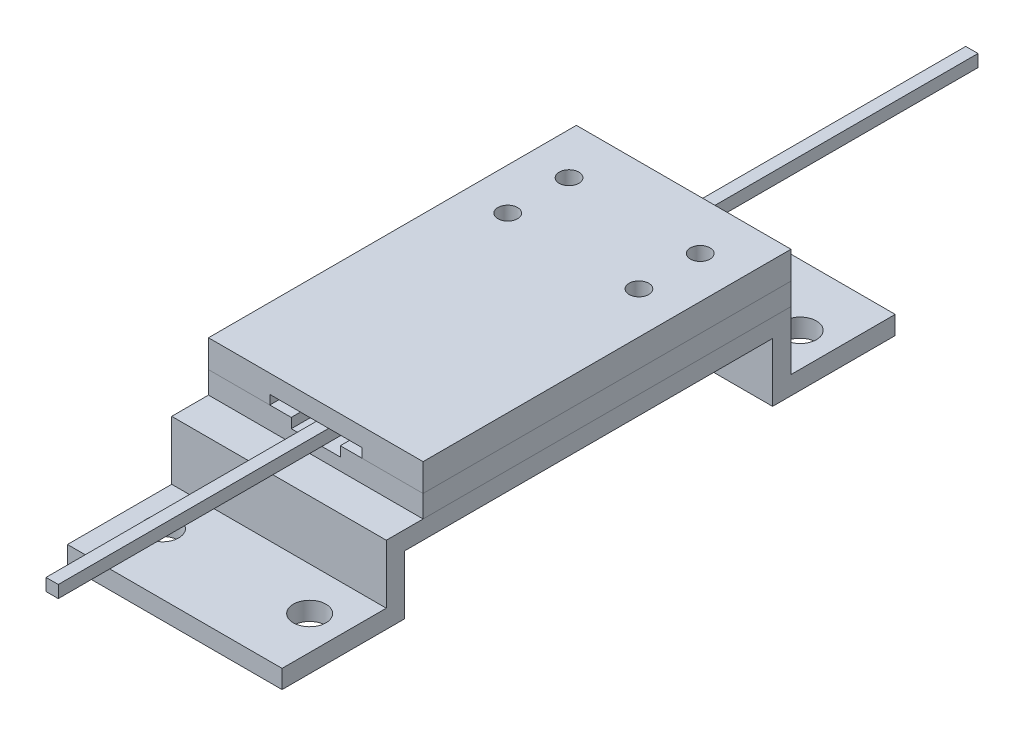
from build123d import *

# Parameters (mm, degrees)
SKETCH1_W           = 17
SKETCH1_H           = 3
BOSS_EXTRUDE1_DEPTH = 35
SKETCH2_R           = 1.6
SKETCH2_R_2         = 2.65
CUT_EXTRUDE1_DEPTH  = 63.319820282
SKETCH4_W           = 35
SKETCH4_H           = 60
SKETCH4_R           = 1.6
BOSS_EXTRUDE2_DEPTH = 2
BOSS_EXTRUDE3_START = 1.6
SKETCH5_W           = 13.5
SKETCH5_H           = 60
SKETCH5_R           = 1.6
BOSS_EXTRUDE3_DEPTH = 1.6
SKETCH6_W           = 7.5
SKETCH6_H           = 3
BOSS_EXTRUDE4_DEPTH = 60
SKETCH5_2_R         = 1.6
CUT_EXTRUDE2_DEPTH  = 63.754760776
SKETCH7_W           = 2
SKETCH7_H           = 150
BOSS_EXTRUDE5_DEPTH = 2


with BuildPart() as part:
    # Sketch1 → Boss-Extrude1 (new body)
    with BuildSketch(Plane(origin=(0, 0, 0), x_dir=(0, 0, -1), z_dir=(1, 0, 0))):
        Polygon((-33, 12.6), (-33, 9.6), (-30, 9.6), (0, 9.6), (0, 12.6), align=None)
        Polygon((0, 12.6), (0, 9.6), (30, 9.6), (33, 9.6), (33, 12.6), align=None)
        Polygon((33, 9.6), (30, 9.6), (30, 0), (33, 0), (33, 3), align=None)
        with Locations((41.5, 1.5)):
            Rectangle(SKETCH1_W, SKETCH1_H)
        Polygon((-33, 9.6), (-33, 3), (-33, 0), (-30, 0), (-30, 9.6), align=None)
        with Locations((-41.5, 1.5)):
            Rectangle(SKETCH1_W, SKETCH1_H)
    extrude(amount=BOSS_EXTRUDE1_DEPTH)

    # Sketch2 → Cut-Extrude1 (cut, through all)
    with BuildSketch(Plane(origin=(0, 12.6, 0), x_dir=(1, 0, 0), z_dir=(0, 1, 0))):
        with Locations(Location((6.8, 25, 0), (0, 0, 270))):
            Circle(SKETCH2_R)
        with Locations(Location((28.2, 25, 0), (0, 0, 270))):
            Circle(SKETCH2_R)
        with Locations(Location((6.8, 15, 0), (0, 0, 270))):
            Circle(SKETCH2_R)
        with Locations(Location((28.2, 15, 0), (0, 0, 270))):
            Circle(SKETCH2_R)
        with Locations(Location((5.5, 40, 0), (0, 0, 270))):
            Circle(SKETCH2_R_2)
        with Locations(Location((29.5, 40, 0), (0, 0, 270))):
            Circle(SKETCH2_R_2)
        with Locations(Location((29.5, -40, 0), (0, 0, 270))):
            Circle(SKETCH2_R_2)
        with Locations(Location((5.5, -40, 0), (0, 0, 270))):
            Circle(SKETCH2_R_2)
        with Locations(Location((6.8, 5, 0), (0, 0, 270))):
            Circle(SKETCH2_R)
        with Locations(Location((28.2, 5, 0), (0, 0, 270))):
            Circle(SKETCH2_R)
        with Locations(Location((6.8, -5, 0), (0, 0, 270))):
            Circle(SKETCH2_R)
        with Locations(Location((28.2, -5, 0), (0, 0, 270))):
            Circle(SKETCH2_R)
        with Locations(Location((6.8, -25, 0), (0, 0, 270))):
            Circle(SKETCH2_R)
        with Locations(Location((28.2, -25, 0), (0, 0, 270))):
            Circle(SKETCH2_R)
    extrude(amount=-CUT_EXTRUDE1_DEPTH, mode=Mode.SUBTRACT)


with BuildPart() as body_2:
    # Sketch4 → Boss-Extrude2 (new body)
    with BuildSketch(Plane(origin=(0, 12.6, 0), x_dir=(1, 0, 0), z_dir=(0, 1, 0))):
        with Locations((17.5, 3)):
            Rectangle(SKETCH4_W, SKETCH4_H)
        with Locations(Location((6.8, 15, 0), (0, 0, 270))):
            Circle(SKETCH4_R, mode=Mode.SUBTRACT)
        with Locations(Location((28.2, 15, 0), (0, 0, 270))):
            Circle(SKETCH4_R, mode=Mode.SUBTRACT)
        with Locations(Location((28.2, 25, 0), (0, 0, 270))):
            Circle(SKETCH4_R, mode=Mode.SUBTRACT)
        with Locations(Location((6.8, 25, 0), (0, 0, 270))):
            Circle(SKETCH4_R, mode=Mode.SUBTRACT)
    extrude(amount=BOSS_EXTRUDE2_DEPTH)

    # Sketch5 → Boss-Extrude3 (add)
    # profile 1 of 2: a face of its own
    with BuildSketch(Plane(origin=(0, 14.6, 0), x_dir=(1, 0, 0), z_dir=(0, 1, 0)).offset(BOSS_EXTRUDE3_START)):
        with Locations((6.75, 3)):
            Rectangle(SKETCH5_W, SKETCH5_H)
        with Locations(Location((6.8, 25, 0), (0, 0, 270))):
            Circle(SKETCH5_R, mode=Mode.SUBTRACT)
        with Locations(Location((6.8, 15, 0), (0, 0, 270))):
            Circle(SKETCH5_R, mode=Mode.SUBTRACT)
        with Locations(Location((6.8, -25, 0), (0, 0, 270))):
            Circle(SKETCH5_R, mode=Mode.SUBTRACT)
        with Locations(Location((6.8, -5, 0), (0, 0, 270))):
            Circle(SKETCH5_R, mode=Mode.SUBTRACT)
        with Locations(Location((6.8, 5, 0), (0, 0, 270))):
            Circle(SKETCH5_R, mode=Mode.SUBTRACT)
    # profile 2 of 2: a face of its own
    with BuildSketch(Plane(origin=(0, 14.6, 0), x_dir=(1, 0, 0), z_dir=(0, 1, 0)).offset(BOSS_EXTRUDE3_START)):
        with Locations((28.25, 3)):
            Rectangle(SKETCH5_W, SKETCH5_H)
        with Locations(Location((28.2, 25, 0), (0, 0, 270))):
            Circle(SKETCH5_R, mode=Mode.SUBTRACT)
        with Locations(Location((28.2, 15, 0), (0, 0, 270))):
            Circle(SKETCH5_R, mode=Mode.SUBTRACT)
        with Locations(Location((28.2, -25, 0), (0, 0, 270))):
            Circle(SKETCH5_R, mode=Mode.SUBTRACT)
        with Locations(Location((28.2, -5, 0), (0, 0, 270))):
            Circle(SKETCH5_R, mode=Mode.SUBTRACT)
        with Locations(Location((28.2, 5, 0), (0, 0, 270))):
            Circle(SKETCH5_R, mode=Mode.SUBTRACT)
    extrude(amount=-BOSS_EXTRUDE3_DEPTH)


with BuildPart() as body_3:
    # Sketch6 → Boss-Extrude4 (new body)
    with BuildSketch(Plane.XY.offset(27)):
        Polygon((25, 20.7), (25, 17.7), (25, 16.2), (35, 16.2), (35, 20.7), align=None)
        with Locations((21.25, 19.2)):
            Rectangle(SKETCH6_W, SKETCH6_H)
        with Locations((13.75, 19.2)):
            Rectangle(SKETCH6_W, SKETCH6_H)
        Polygon((0, 20.7), (0, 16.2), (10, 16.2), (10, 17.7), (10, 20.7), align=None)
    extrude(amount=-BOSS_EXTRUDE4_DEPTH)

    # Sketch5<2> → Cut-Extrude2 (cut, through all)
    with BuildSketch(Plane(origin=(0, 14.6, 0), x_dir=(1, 0, 0), z_dir=(0, 1, 0))):
        with Locations(Location((6.8, 25, 0), (0, 0, 270))):
            Circle(SKETCH5_2_R)
        with Locations(Location((28.2, 25, 0), (0, 0, 270))):
            Circle(SKETCH5_2_R)
        with Locations(Location((28.2, 15, 0), (0, 0, 270))):
            Circle(SKETCH5_2_R)
        with Locations(Location((6.8, 15, 0), (0, 0, 270))):
            Circle(SKETCH5_2_R)
    extrude(amount=CUT_EXTRUDE2_DEPTH, mode=Mode.SUBTRACT)


with BuildPart() as body_4:
    # Sketch7 → Boss-Extrude5 (new body)
    with BuildSketch(Plane(origin=(0, 14.6, 0), x_dir=(1, 0, 0), z_dir=(0, 1, 0))):
        with Locations((17.5, 5)):
            Rectangle(SKETCH7_W, SKETCH7_H)
    extrude(amount=BOSS_EXTRUDE5_DEPTH)


solid = Compound([part.part, body_2.part, body_3.part, body_4.part])
